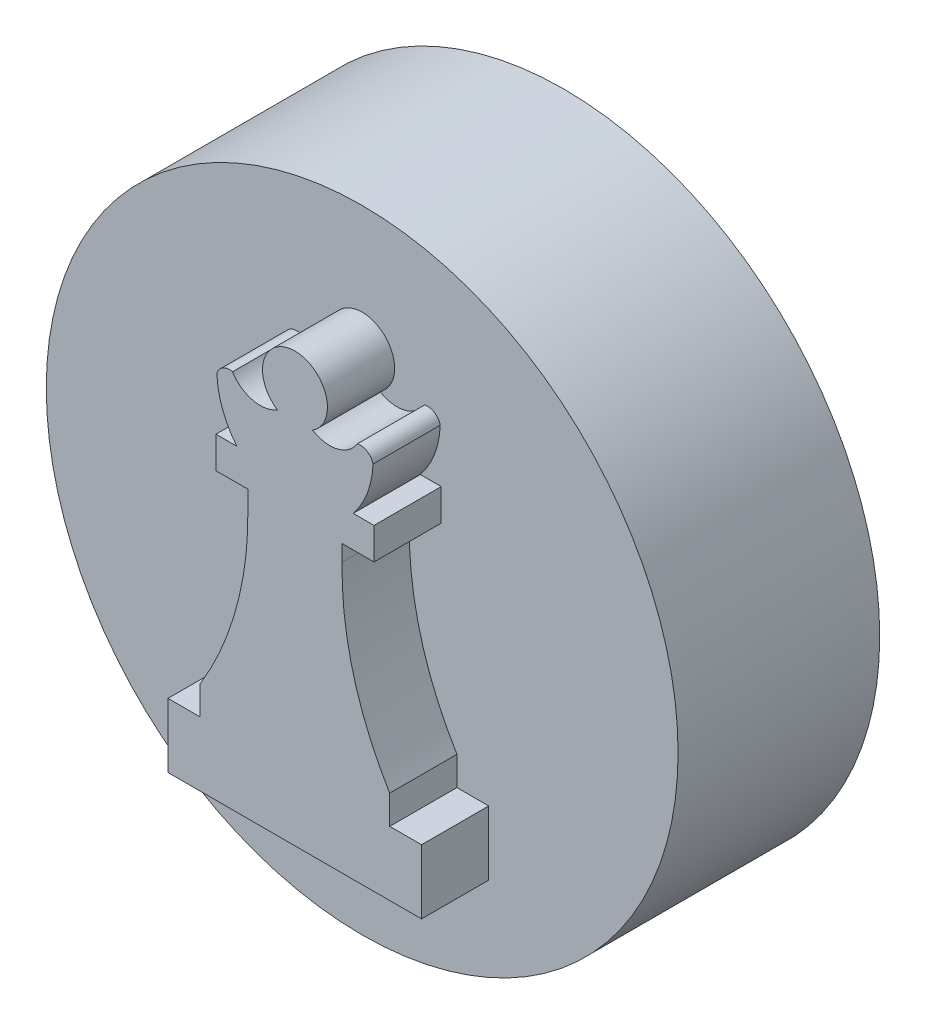
from build123d import *

# Parameters (mm, degrees)
SKETCH1_R           = 11.938
SKETCH1_R_2         = 8.763
BOSS_EXTRUDE1_DEPTH = 5.08
SKETCH2_R           = 11.938
BOSS_EXTRUDE2_DEPTH = 2.54
BOSS_EXTRUDE7_DEPTH = 2.54


with BuildPart() as part:
    # Sketch1 → Boss-Extrude1 (new body)
    with BuildSketch(Plane.XY):
        Circle(SKETCH1_R)
        Circle(SKETCH1_R_2, mode=Mode.SUBTRACT)
    extrude(amount=BOSS_EXTRUDE1_DEPTH)

    # Sketch2 → Boss-Extrude2 (add)
    with BuildSketch(Plane.XY.offset(5.08)):
        Circle(SKETCH2_R)
    extrude(amount=BOSS_EXTRUDE2_DEPTH)

    # Sketch3 → Boss-Extrude7 (add)
    with BuildSketch(Plane.XY.offset(7.62)):
        with BuildLine():
            Line((-3.581203205, -5.323066216), (-3.581203205, -4.234628776))
            ThreePointArc((-3.581203205, -4.234628776), (-2.206146934, -1.034066779), (-1.780332767, 2.423252867))
            Line((-1.780332767, 2.423252867), (-1.780332767, 3.033045049))
            Line((-1.780332767, 3.033045049), (-2.98662319, 3.033045049))
            Line((-2.98662319, 3.033045049), (-2.98662319, 4.229885576))
            Line((-2.98662319, 4.229885576), (-2.200089182, 4.229885576))
            ThreePointArc((-2.200089182, 4.229885576), (-2.736363422, 5.164361527), (-2.950097006, 6.220369728))
            ThreePointArc((-2.950097006, 6.220369728), (-2.730043081, 6.525801031), (-2.358468914, 6.586171955))
            ThreePointArc((-2.358468914, 6.586171955), (-1.595642249, 6.036578644), (-0.667621184, 6.187357394))
            ThreePointArc((-0.667621184, 6.187357394), (0, 8.443971822), (0.667621184, 6.187357394))
            ThreePointArc((0.667621184, 6.187357394), (1.595642249, 6.036578644), (2.358468914, 6.586171955))
            ThreePointArc((2.358468914, 6.586171955), (2.730043081, 6.525801031), (2.950097006, 6.220369728))
            ThreePointArc((2.950097006, 6.220369728), (2.736363422, 5.164361527), (2.200089182, 4.229885576))
            Line((2.200089182, 4.229885576), (2.98662319, 4.229885576))
            Line((2.98662319, 4.229885576), (2.98662319, 3.033045049))
            Line((2.98662319, 3.033045049), (1.780332767, 3.033045049))
            Line((1.780332767, 3.033045049), (1.780332767, 2.423252867))
            ThreePointArc((1.780332767, 2.423252867), (2.206146934, -1.034066779), (3.581203205, -4.234628776))
            Line((3.581203205, -4.234628776), (3.581203205, -5.323066216))
            Line((3.581203205, -5.323066216), (4.782890844, -5.323066216))
            Line((4.782890844, -5.323066216), (4.782890844, -7.750587613))
            Line((4.782890844, -7.750587613), (-4.798911093, -7.750587613))
            Line((-4.798911093, -7.750587613), (-4.798911093, -5.323066216))
            Line((-4.798911093, -5.323066216), (-3.581203205, -5.323066216))
        make_face()
    extrude(amount=BOSS_EXTRUDE7_DEPTH)


solid = part.part
